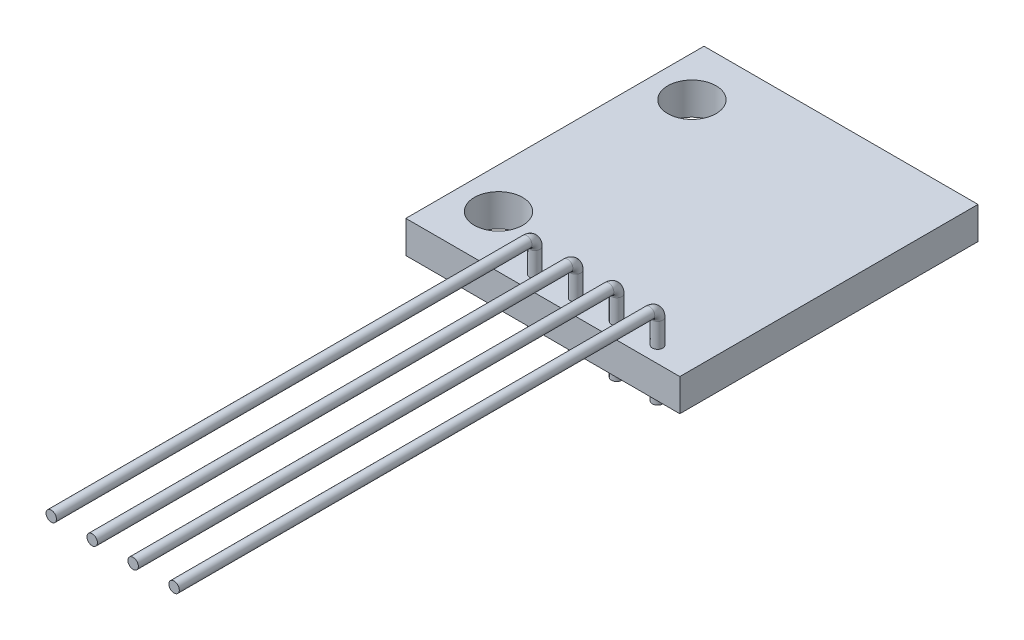
from build123d import *

# Parameters (mm, degrees)
SKETCH1_W           = 17
SKETCH1_H           = 18.5
SKETCH1_R           = 1.5
BOSS_EXTRUDE1_DEPTH = 2
SKETCH3_R           = 0.325
LPATTERN1_COUNT     = 4
LPATTERN1_PITCH     = 2.54


with BuildPart() as part:
    # Sketch1 → Boss-Extrude1 (new body)
    with BuildSketch(Plane(origin=(0, 0, 0), x_dir=(1, 0, 0), z_dir=(0, 1, 0))):
        with Locations((8.5, 9.25)):
            Rectangle(SKETCH1_W, SKETCH1_H)
        with Locations(Location((2.5, 15.25, 0), (0, 0, 270))):
            Circle(SKETCH1_R, mode=Mode.SUBTRACT)
        with Locations(Location((2.5, 3.25, 0), (0, 0, 270))):
            Circle(SKETCH1_R, mode=Mode.SUBTRACT)
    extrude(amount=BOSS_EXTRUDE1_DEPTH)

    # Sweep1: sweep along a path in Sketch2
    with BuildLine(Plane.ZY.offset(-7)) as sweep1_path:
        Line((-1, -1), (-1, 3.5))
        ThreePointArc((-1, 3.5), (-0.853553391, 3.853553391), (-0.5, 4))
        Line((-0.5, 4), (29, 4))
    # Sketch3 → Sweep1 (sweep)
    with BuildSketch(Plane(origin=(0, 2, 0), x_dir=(1, 0, 0), z_dir=(0, 1, 0))):
        with Locations((7, 1)):
            Circle(SKETCH3_R)
    sweep1 = sweep(path=sweep1_path.line)

    # LPattern1: Sweep1 ×4
    with Locations(*[(i * LPATTERN1_PITCH, 0, 0) for i in range(1, LPATTERN1_COUNT)]):
        add(sweep1)


solid = part.part
